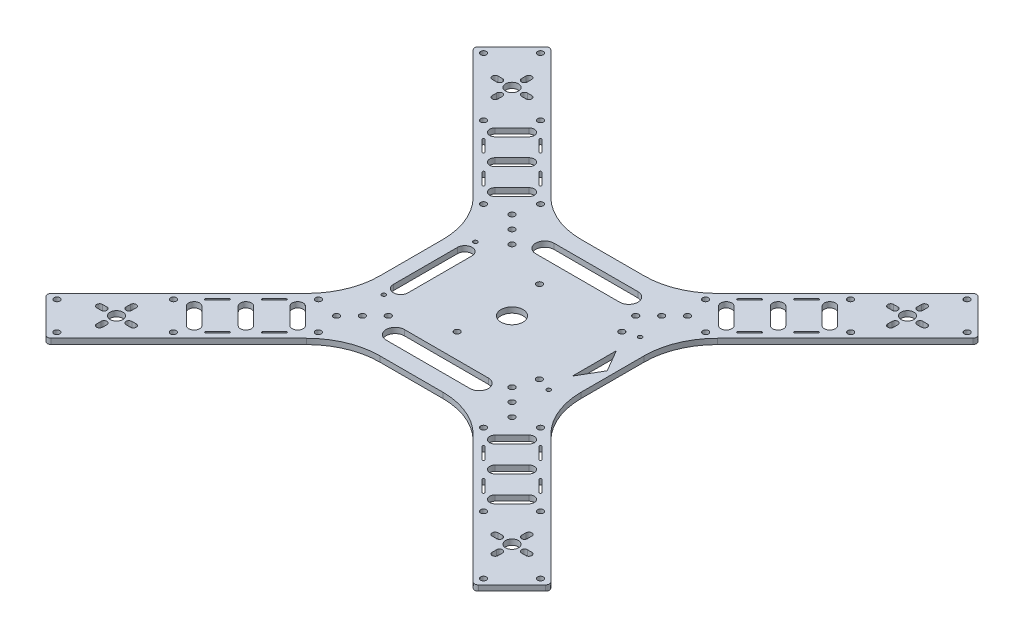
from build123d import *

# Parameters (mm, degrees)
SKETCH_1_R      = 1.6
SKETCH_1_R_2    = 3.5
SKETCH_1_R_3    = 1.1
SKETCH_1_R_4    = 6
EXTRUDE_2_DEPTH = 3
FILLET_1_R      = 2
FILLET_2_R      = 2


with BuildPart() as part:
    # 草图1 → 凸台-拉伸2 (new body)
    with BuildSketch(Plane(origin=(0, 0, 0), x_dir=(1, 0, 0), z_dir=(0, 1, 0))):
        with BuildLine():
            Line((-17.218254069, 55), (17.218254069, 55))
            ThreePointArc((17.218254069, 55), (32.525591364, 58.0448187), (45.502525317, 66.715728753))
            Line((45.502525317, 66.715728753), (116.672618896, 137.885822331))
            Line((116.672618896, 137.885822331), (137.885822331, 116.672618896))
            Line((137.885822331, 116.672618896), (66.715728753, 45.502525317))
            ThreePointArc((66.715728753, 45.502525317), (58.0448187, 32.525591364), (55, 17.218254069))
            Line((55, 17.218254069), (55, -17.218254069))
            ThreePointArc((55, -17.218254069), (58.0448187, -32.525591364), (66.715728753, -45.502525317))
            Line((66.715728753, -45.502525317), (137.885822331, -116.672618896))
            Line((137.885822331, -116.672618896), (116.672618896, -137.885822331))
            Line((116.672618896, -137.885822331), (45.502525317, -66.715728753))
            ThreePointArc((45.502525317, -66.715728753), (32.525591364, -58.0448187), (17.218254069, -55))
            Line((17.218254069, -55), (-17.218254069, -55))
            ThreePointArc((-17.218254069, -55), (-32.525591364, -58.0448187), (-45.502525317, -66.715728753))
            Line((-45.502525317, -66.715728753), (-116.672618896, -137.885822331))
            Line((-116.672618896, -137.885822331), (-137.885822331, -116.672618896))
            Line((-137.885822331, -116.672618896), (-66.715728753, -45.502525317))
            ThreePointArc((-66.715728753, -45.502525317), (-58.0448187, -32.525591364), (-55, -17.218254069))
            Line((-55, -17.218254069), (-55, 17.218254069))
            ThreePointArc((-55, 17.218254069), (-58.0448187, 32.525591364), (-66.715728753, 45.502525317))
            Line((-66.715728753, 45.502525317), (-137.885822331, 116.672618896))
            Line((-137.885822331, 116.672618896), (-116.672618896, 137.885822331))
            Line((-116.672618896, 137.885822331), (-45.502525317, 66.715728753))
            ThreePointArc((-45.502525317, 66.715728753), (-32.525591364, 58.0448187), (-17.218254069, 55))
        make_face()
        with Locations(Location((84.69848481, 100.254833996, 0), (0, 0, 270))):
            Circle(SKETCH_1_R, mode=Mode.SUBTRACT)
        with Locations(Location((100.254833996, 84.69848481, 0), (0, 0, 270))):
            Circle(SKETCH_1_R, mode=Mode.SUBTRACT)
        with Locations(Location((60.656854249, 45.100505063, 0), (0, 0, 270))):
            Circle(SKETCH_1_R, mode=Mode.SUBTRACT)
        with Locations(Location((45.100505063, 60.656854249, 0), (0, 0, 270))):
            Circle(SKETCH_1_R, mode=Mode.SUBTRACT)
        with Locations(Location((108.033008589, 108.033008589, 0), (0, 0, 270))):
            Circle(SKETCH_1_R_2, mode=Mode.SUBTRACT)
        with Locations(Location((116.518289963, 132.074639149, 0), (0, 0, 270))):
            Circle(SKETCH_1_R, mode=Mode.SUBTRACT)
        with Locations(Location((132.074639149, 116.518289963, 0), (0, 0, 270))):
            Circle(SKETCH_1_R, mode=Mode.SUBTRACT)
        with Locations(Location((100.254833996, -84.69848481, 0), (0, 0, 270))):
            Circle(SKETCH_1_R, mode=Mode.SUBTRACT)
        with Locations(Location((84.69848481, -100.254833996, 0), (0, 0, 270))):
            Circle(SKETCH_1_R, mode=Mode.SUBTRACT)
        with Locations(Location((45.100505063, -60.656854249, 0), (0, 0, 270))):
            Circle(SKETCH_1_R, mode=Mode.SUBTRACT)
        with Locations(Location((60.656854249, -45.100505063, 0), (0, 0, 270))):
            Circle(SKETCH_1_R, mode=Mode.SUBTRACT)
        with Locations(Location((108.033008589, -108.033008589, 0), (0, 0, 270))):
            Circle(SKETCH_1_R_2, mode=Mode.SUBTRACT)
        with Locations(Location((132.074639149, -116.518289963, 0), (0, 0, 270))):
            Circle(SKETCH_1_R, mode=Mode.SUBTRACT)
        with Locations(Location((116.518289963, -132.074639149, 0), (0, 0, 270))):
            Circle(SKETCH_1_R, mode=Mode.SUBTRACT)
        with Locations(Location((-84.69848481, -100.254833996, 0), (0, 0, 270))):
            Circle(SKETCH_1_R, mode=Mode.SUBTRACT)
        with Locations(Location((-100.254833996, -84.69848481, 0), (0, 0, 270))):
            Circle(SKETCH_1_R, mode=Mode.SUBTRACT)
        with Locations(Location((-60.656854249, -45.100505063, 0), (0, 0, 270))):
            Circle(SKETCH_1_R, mode=Mode.SUBTRACT)
        with Locations(Location((-45.100505063, -60.656854249, 0), (0, 0, 270))):
            Circle(SKETCH_1_R, mode=Mode.SUBTRACT)
        with Locations(Location((-108.033008589, -108.033008589, 0), (0, 0, 270))):
            Circle(SKETCH_1_R_2, mode=Mode.SUBTRACT)
        with Locations(Location((-116.518289963, -132.074639149, 0), (0, 0, 270))):
            Circle(SKETCH_1_R, mode=Mode.SUBTRACT)
        with Locations(Location((-132.074639149, -116.518289963, 0), (0, 0, 270))):
            Circle(SKETCH_1_R, mode=Mode.SUBTRACT)
        with Locations(Location((-100.254833996, 84.69848481, 0), (0, 0, 270))):
            Circle(SKETCH_1_R, mode=Mode.SUBTRACT)
        with Locations(Location((-84.69848481, 100.254833996, 0), (0, 0, 270))):
            Circle(SKETCH_1_R, mode=Mode.SUBTRACT)
        with Locations(Location((-45.100505063, 60.656854249, 0), (0, 0, 270))):
            Circle(SKETCH_1_R, mode=Mode.SUBTRACT)
        with Locations(Location((-60.656854249, 45.100505063, 0), (0, 0, 270))):
            Circle(SKETCH_1_R, mode=Mode.SUBTRACT)
        with Locations(Location((-108.033008589, 108.033008589, 0), (0, 0, 270))):
            Circle(SKETCH_1_R_2, mode=Mode.SUBTRACT)
        with Locations(Location((-132.074639149, 116.518289963, 0), (0, 0, 270))):
            Circle(SKETCH_1_R, mode=Mode.SUBTRACT)
        with Locations(Location((-116.518289963, 132.074639149, 0), (0, 0, 270))):
            Circle(SKETCH_1_R, mode=Mode.SUBTRACT)
        with Locations(Location((47.928932188, 47.928932188, 0), (0, 0, 270))):
            Circle(SKETCH_1_R, mode=Mode.SUBTRACT)
        with Locations(Location((40.857864376, 40.857864376, 0), (0, 0, 270))):
            Circle(SKETCH_1_R, mode=Mode.SUBTRACT)
        with Locations(Location((33.786796564, 33.786796564, 0), (0, 0, 270))):
            Circle(SKETCH_1_R, mode=Mode.SUBTRACT)
        with Locations(Location((47.928932188, -47.928932188, 0), (0, 0, 270))):
            Circle(SKETCH_1_R, mode=Mode.SUBTRACT)
        with Locations(Location((40.857864376, -40.857864376, 0), (0, 0, 270))):
            Circle(SKETCH_1_R, mode=Mode.SUBTRACT)
        with Locations(Location((33.786796564, -33.786796564, 0), (0, 0, 270))):
            Circle(SKETCH_1_R, mode=Mode.SUBTRACT)
        with Locations(Location((-47.928932188, -47.928932188, 0), (0, 0, 270))):
            Circle(SKETCH_1_R, mode=Mode.SUBTRACT)
        with Locations(Location((-40.857864376, -40.857864376, 0), (0, 0, 270))):
            Circle(SKETCH_1_R, mode=Mode.SUBTRACT)
        with Locations(Location((-33.786796564, -33.786796564, 0), (0, 0, 270))):
            Circle(SKETCH_1_R, mode=Mode.SUBTRACT)
        with Locations(Location((-47.928932188, 47.928932188, 0), (0, 0, 270))):
            Circle(SKETCH_1_R, mode=Mode.SUBTRACT)
        with Locations(Location((-40.857864376, 40.857864376, 0), (0, 0, 270))):
            Circle(SKETCH_1_R, mode=Mode.SUBTRACT)
        with Locations(Location((-33.786796564, 33.786796564, 0), (0, 0, 270))):
            Circle(SKETCH_1_R, mode=Mode.SUBTRACT)
        with Locations(Location((-44.999999799, 25, 0), (0, 0, 270))):
            Circle(SKETCH_1_R_3, mode=Mode.SUBTRACT)
        with Locations(Location((45.000000201, 25, 0), (0, 0, 270))):
            Circle(SKETCH_1_R_3, mode=Mode.SUBTRACT)
        with Locations(Location((45.000000201, -25, 0), (0, 0, 270))):
            Circle(SKETCH_1_R_3, mode=Mode.SUBTRACT)
        with Locations(Location((-44.999999799, -25, 0), (0, 0, 270))):
            Circle(SKETCH_1_R_3, mode=Mode.SUBTRACT)
        with Locations(Location((0, 0, 0), (0, 0, 270))):
            Circle(SKETCH_1_R_4, mode=Mode.SUBTRACT)
        with Locations(Location((-7.5, 22.5, 0), (0, 0, 270))):
            Circle(SKETCH_1_R, mode=Mode.SUBTRACT)
        with Locations(Location((37.5, 22.5, 0), (0, 0, 270))):
            Circle(SKETCH_1_R, mode=Mode.SUBTRACT)
        with Locations(Location((37.5, -22.5, 0), (0, 0, 270))):
            Circle(SKETCH_1_R, mode=Mode.SUBTRACT)
        with Locations(Location((-7.5, -22.5, 0), (0, 0, 270))):
            Circle(SKETCH_1_R, mode=Mode.SUBTRACT)
        with BuildLine():
            Line((70.202795796, 79.395183951), (79.395183951, 70.202795796))
            ThreePointArc((79.395183951, 70.202795796), (79.395183951, 65.960155108), (75.152543264, 65.960155108))
            Line((75.152543264, 65.960155108), (65.960155108, 75.152543264))
            ThreePointArc((65.960155108, 75.152543264), (65.960155108, 79.395183951), (70.202795796, 79.395183951))
        make_face(mode=Mode.SUBTRACT)
        with BuildLine():
            Line((56.060660172, 65.253048327), (65.253048327, 56.060660172))
            ThreePointArc((65.253048327, 56.060660172), (65.253048327, 51.818019485), (61.01040764, 51.818019485))
            Line((61.01040764, 51.818019485), (51.818019485, 61.01040764))
            ThreePointArc((51.818019485, 61.01040764), (51.818019485, 65.253048327), (56.060660172, 65.253048327))
        make_face(mode=Mode.SUBTRACT)
        with BuildLine():
            Line((84.344931419, 93.537319575), (93.537319575, 84.344931419))
            ThreePointArc((93.537319575, 84.344931419), (93.537319575, 80.102290732), (89.294678888, 80.102290732))
            Line((89.294678888, 80.102290732), (80.102290732, 89.294678888))
            ThreePointArc((80.102290732, 89.294678888), (80.102290732, 93.537319575), (84.344931419, 93.537319575))
        make_face(mode=Mode.SUBTRACT)
        with BuildLine():
            Line((109.633008589, 117.233008589), (109.633008589, 114.833008589))
            ThreePointArc((109.633008589, 114.833008589), (108.033008589, 113.233008589), (106.433008589, 114.833008589))
            Line((106.433008589, 114.833008589), (106.433008589, 117.233008589))
            ThreePointArc((106.433008589, 117.233008589), (108.033008589, 118.833008589), (109.633008589, 117.233008589))
        make_face(mode=Mode.SUBTRACT)
        with BuildLine():
            Line((117.233008589, 106.433008589), (114.833008589, 106.433008589))
            ThreePointArc((114.833008589, 106.433008589), (113.233008589, 108.033008589), (114.833008589, 109.633008589))
            Line((114.833008589, 109.633008589), (117.233008589, 109.633008589))
            ThreePointArc((117.233008589, 109.633008589), (118.833008589, 108.033008589), (117.233008589, 106.433008589))
        make_face(mode=Mode.SUBTRACT)
        with BuildLine():
            Line((106.433008589, 98.833008589), (106.433008589, 101.233008589))
            ThreePointArc((106.433008589, 101.233008589), (108.033008589, 102.833008589), (109.633008589, 101.233008589))
            Line((109.633008589, 101.233008589), (109.633008589, 98.833008589))
            ThreePointArc((109.633008589, 98.833008589), (108.033008589, 97.233008589), (106.433008589, 98.833008589))
        make_face(mode=Mode.SUBTRACT)
        with BuildLine():
            Line((98.833008589, 109.633008589), (101.233008589, 109.633008589))
            ThreePointArc((101.233008589, 109.633008589), (102.833008589, 108.033008589), (101.233008589, 106.433008589))
            Line((101.233008589, 106.433008589), (98.833008589, 106.433008589))
            ThreePointArc((98.833008589, 106.433008589), (97.233008589, 108.033008589), (98.833008589, 109.633008589))
        make_face(mode=Mode.SUBTRACT)
        with BuildLine():
            Line((65.253048327, -56.060660172), (56.060660172, -65.253048327))
            ThreePointArc((56.060660172, -65.253048327), (51.818019485, -65.253048327), (51.818019485, -61.01040764))
            Line((51.818019485, -61.01040764), (61.01040764, -51.818019485))
            ThreePointArc((61.01040764, -51.818019485), (65.253048327, -51.818019485), (65.253048327, -56.060660172))
        make_face(mode=Mode.SUBTRACT)
        with BuildLine():
            Line((79.395183951, -70.202795796), (70.202795796, -79.395183951))
            ThreePointArc((70.202795796, -79.395183951), (65.960155108, -79.395183951), (65.960155108, -75.152543264))
            Line((65.960155108, -75.152543264), (75.152543264, -65.960155108))
            ThreePointArc((75.152543264, -65.960155108), (79.395183951, -65.960155108), (79.395183951, -70.202795796))
        make_face(mode=Mode.SUBTRACT)
        with BuildLine():
            Line((93.537319575, -84.344931419), (84.344931419, -93.537319575))
            ThreePointArc((84.344931419, -93.537319575), (80.102290732, -93.537319575), (80.102290732, -89.294678888))
            Line((80.102290732, -89.294678888), (89.294678888, -80.102290732))
            ThreePointArc((89.294678888, -80.102290732), (93.537319575, -80.102290732), (93.537319575, -84.344931419))
        make_face(mode=Mode.SUBTRACT)
        with BuildLine():
            Line((117.233008589, -109.633008589), (114.833008589, -109.633008589))
            ThreePointArc((114.833008589, -109.633008589), (113.233008589, -108.033008589), (114.833008589, -106.433008589))
            Line((114.833008589, -106.433008589), (117.233008589, -106.433008589))
            ThreePointArc((117.233008589, -106.433008589), (118.833008589, -108.033008589), (117.233008589, -109.633008589))
        make_face(mode=Mode.SUBTRACT)
        with BuildLine():
            Line((106.433008589, -117.233008589), (106.433008589, -114.833008589))
            ThreePointArc((106.433008589, -114.833008589), (108.033008589, -113.233008589), (109.633008589, -114.833008589))
            Line((109.633008589, -114.833008589), (109.633008589, -117.233008589))
            ThreePointArc((109.633008589, -117.233008589), (108.033008589, -118.833008589), (106.433008589, -117.233008589))
        make_face(mode=Mode.SUBTRACT)
        with BuildLine():
            Line((98.833008589, -106.433008589), (101.233008589, -106.433008589))
            ThreePointArc((101.233008589, -106.433008589), (102.833008589, -108.033008589), (101.233008589, -109.633008589))
            Line((101.233008589, -109.633008589), (98.833008589, -109.633008589))
            ThreePointArc((98.833008589, -109.633008589), (97.233008589, -108.033008589), (98.833008589, -106.433008589))
        make_face(mode=Mode.SUBTRACT)
        with BuildLine():
            Line((109.633008589, -98.833008589), (109.633008589, -101.233008589))
            ThreePointArc((109.633008589, -101.233008589), (108.033008589, -102.833008589), (106.433008589, -101.233008589))
            Line((106.433008589, -101.233008589), (106.433008589, -98.833008589))
            ThreePointArc((106.433008589, -98.833008589), (108.033008589, -97.233008589), (109.633008589, -98.833008589))
        make_face(mode=Mode.SUBTRACT)
        with BuildLine():
            Line((-56.060660172, -65.253048327), (-65.253048327, -56.060660172))
            ThreePointArc((-65.253048327, -56.060660172), (-65.253048327, -51.818019485), (-61.01040764, -51.818019485))
            Line((-61.01040764, -51.818019485), (-51.818019485, -61.01040764))
            ThreePointArc((-51.818019485, -61.01040764), (-51.818019485, -65.253048327), (-56.060660172, -65.253048327))
        make_face(mode=Mode.SUBTRACT)
        with BuildLine():
            Line((-70.202795796, -79.395183951), (-79.395183951, -70.202795796))
            ThreePointArc((-79.395183951, -70.202795796), (-79.395183951, -65.960155108), (-75.152543264, -65.960155108))
            Line((-75.152543264, -65.960155108), (-65.960155108, -75.152543264))
            ThreePointArc((-65.960155108, -75.152543264), (-65.960155108, -79.395183951), (-70.202795796, -79.395183951))
        make_face(mode=Mode.SUBTRACT)
        with BuildLine():
            Line((-84.344931419, -93.537319575), (-93.537319575, -84.344931419))
            ThreePointArc((-93.537319575, -84.344931419), (-93.537319575, -80.102290732), (-89.294678888, -80.102290732))
            Line((-89.294678888, -80.102290732), (-80.102290732, -89.294678888))
            ThreePointArc((-80.102290732, -89.294678888), (-80.102290732, -93.537319575), (-84.344931419, -93.537319575))
        make_face(mode=Mode.SUBTRACT)
        with BuildLine():
            Line((-109.633008589, -117.233008589), (-109.633008589, -114.833008589))
            ThreePointArc((-109.633008589, -114.833008589), (-108.033008589, -113.233008589), (-106.433008589, -114.833008589))
            Line((-106.433008589, -114.833008589), (-106.433008589, -117.233008589))
            ThreePointArc((-106.433008589, -117.233008589), (-108.033008589, -118.833008589), (-109.633008589, -117.233008589))
        make_face(mode=Mode.SUBTRACT)
        with BuildLine():
            Line((-117.233008589, -106.433008589), (-114.833008589, -106.433008589))
            ThreePointArc((-114.833008589, -106.433008589), (-113.233008589, -108.033008589), (-114.833008589, -109.633008589))
            Line((-114.833008589, -109.633008589), (-117.233008589, -109.633008589))
            ThreePointArc((-117.233008589, -109.633008589), (-118.833008589, -108.033008589), (-117.233008589, -106.433008589))
        make_face(mode=Mode.SUBTRACT)
        with BuildLine():
            Line((-106.433008589, -98.833008589), (-106.433008589, -101.233008589))
            ThreePointArc((-106.433008589, -101.233008589), (-108.033008589, -102.833008589), (-109.633008589, -101.233008589))
            Line((-109.633008589, -101.233008589), (-109.633008589, -98.833008589))
            ThreePointArc((-109.633008589, -98.833008589), (-108.033008589, -97.233008589), (-106.433008589, -98.833008589))
        make_face(mode=Mode.SUBTRACT)
        with BuildLine():
            Line((-98.833008589, -109.633008589), (-101.233008589, -109.633008589))
            ThreePointArc((-101.233008589, -109.633008589), (-102.833008589, -108.033008589), (-101.233008589, -106.433008589))
            Line((-101.233008589, -106.433008589), (-98.833008589, -106.433008589))
            ThreePointArc((-98.833008589, -106.433008589), (-97.233008589, -108.033008589), (-98.833008589, -109.633008589))
        make_face(mode=Mode.SUBTRACT)
        with BuildLine():
            Line((-65.253048327, 56.060660172), (-56.060660172, 65.253048327))
            ThreePointArc((-56.060660172, 65.253048327), (-51.818019485, 65.253048327), (-51.818019485, 61.01040764))
            Line((-51.818019485, 61.01040764), (-61.01040764, 51.818019485))
            ThreePointArc((-61.01040764, 51.818019485), (-65.253048327, 51.818019485), (-65.253048327, 56.060660172))
        make_face(mode=Mode.SUBTRACT)
        with BuildLine():
            Line((-79.395183951, 70.202795796), (-70.202795796, 79.395183951))
            ThreePointArc((-70.202795796, 79.395183951), (-65.960155108, 79.395183951), (-65.960155108, 75.152543264))
            Line((-65.960155108, 75.152543264), (-75.152543264, 65.960155108))
            ThreePointArc((-75.152543264, 65.960155108), (-79.395183951, 65.960155108), (-79.395183951, 70.202795796))
        make_face(mode=Mode.SUBTRACT)
        with BuildLine():
            Line((-93.537319575, 84.344931419), (-84.344931419, 93.537319575))
            ThreePointArc((-84.344931419, 93.537319575), (-80.102290732, 93.537319575), (-80.102290732, 89.294678888))
            Line((-80.102290732, 89.294678888), (-89.294678888, 80.102290732))
            ThreePointArc((-89.294678888, 80.102290732), (-93.537319575, 80.102290732), (-93.537319575, 84.344931419))
        make_face(mode=Mode.SUBTRACT)
        with BuildLine():
            Line((-117.233008589, 109.633008589), (-114.833008589, 109.633008589))
            ThreePointArc((-114.833008589, 109.633008589), (-113.233008589, 108.033008589), (-114.833008589, 106.433008589))
            Line((-114.833008589, 106.433008589), (-117.233008589, 106.433008589))
            ThreePointArc((-117.233008589, 106.433008589), (-118.833008589, 108.033008589), (-117.233008589, 109.633008589))
        make_face(mode=Mode.SUBTRACT)
        with BuildLine():
            Line((-106.433008589, 117.233008589), (-106.433008589, 114.833008589))
            ThreePointArc((-106.433008589, 114.833008589), (-108.033008589, 113.233008589), (-109.633008589, 114.833008589))
            Line((-109.633008589, 114.833008589), (-109.633008589, 117.233008589))
            ThreePointArc((-109.633008589, 117.233008589), (-108.033008589, 118.833008589), (-106.433008589, 117.233008589))
        make_face(mode=Mode.SUBTRACT)
        with BuildLine():
            Line((-98.833008589, 106.433008589), (-101.233008589, 106.433008589))
            ThreePointArc((-101.233008589, 106.433008589), (-102.833008589, 108.033008589), (-101.233008589, 109.633008589))
            Line((-101.233008589, 109.633008589), (-98.833008589, 109.633008589))
            ThreePointArc((-98.833008589, 109.633008589), (-97.233008589, 108.033008589), (-98.833008589, 106.433008589))
        make_face(mode=Mode.SUBTRACT)
        with BuildLine():
            Line((-109.633008589, 98.833008589), (-109.633008589, 101.233008589))
            ThreePointArc((-109.633008589, 101.233008589), (-108.033008589, 102.833008589), (-106.433008589, 101.233008589))
            Line((-106.433008589, 101.233008589), (-106.433008589, 98.833008589))
            ThreePointArc((-106.433008589, 98.833008589), (-108.033008589, 97.233008589), (-109.633008589, 98.833008589))
        make_face(mode=Mode.SUBTRACT)
        with BuildLine():
            Line((-22.928932188, 45.857864376), (22.928932188, 45.857864376))
            ThreePointArc((22.928932188, 45.857864376), (27.928932188, 40.857864376), (22.928932188, 35.857864376))
            Line((22.928932188, 35.857864376), (-22.928932188, 35.857864376))
            ThreePointArc((-22.928932188, 35.857864376), (-27.928932188, 40.857864376), (-22.928932188, 45.857864376))
        make_face(mode=Mode.SUBTRACT)
        Polygon((45.000000201, 0), (45.000000201, 12), (52, 0), (45.000000201, -12), align=None, mode=Mode.SUBTRACT)
        with BuildLine():
            Line((-22.928932188, -45.857864376), (22.928932188, -45.857864376))
            ThreePointArc((22.928932188, -45.857864376), (27.928932188, -40.857864376), (22.928932188, -35.857864376))
            Line((22.928932188, -35.857864376), (-22.928932188, -35.857864376))
            ThreePointArc((-22.928932188, -35.857864376), (-27.928932188, -40.857864376), (-22.928932188, -45.857864376))
        make_face(mode=Mode.SUBTRACT)
        with BuildLine():
            Line((-39.293343511, 17.5), (-39.293343511, -17.5))
            ThreePointArc((-39.293343511, -17.5), (-43.293343511, -21.5), (-47.293343511, -17.5))
            Line((-47.293343511, -17.5), (-47.293343511, 17.5))
            ThreePointArc((-47.293343511, 17.5), (-43.293343511, 21.5), (-39.293343511, 17.5))
        make_face(mode=Mode.SUBTRACT)
        with BuildLine():
            Line((69.142135624, 54.292893219), (75.506096654, 60.656854249))
            ThreePointArc((75.506096654, 60.656854249), (76.213203436, 60.656854249), (76.213203436, 59.949747468))
            Line((76.213203436, 59.949747468), (69.849242405, 53.585786438))
            ThreePointArc((69.849242405, 53.585786438), (69.142135624, 53.585786438), (69.142135624, 54.292893219))
        make_face(mode=Mode.SUBTRACT)
        with BuildLine():
            Line((84.69848481, 69.849242405), (91.062445841, 76.213203436))
            ThreePointArc((91.062445841, 76.213203436), (91.769552622, 76.213203436), (91.769552622, 75.506096654))
            Line((91.769552622, 75.506096654), (85.405591591, 69.142135624))
            ThreePointArc((85.405591591, 69.142135624), (84.69848481, 69.142135624), (84.69848481, 69.849242405))
        make_face(mode=Mode.SUBTRACT)
        with BuildLine():
            Line((54.292893219, 69.142135624), (60.656854249, 75.506096654))
            ThreePointArc((60.656854249, 75.506096654), (60.656854249, 76.213203436), (59.949747468, 76.213203436))
            Line((59.949747468, 76.213203436), (53.585786438, 69.849242405))
            ThreePointArc((53.585786438, 69.849242405), (53.585786438, 69.142135624), (54.292893219, 69.142135624))
        make_face(mode=Mode.SUBTRACT)
        with BuildLine():
            Line((69.849242405, 84.69848481), (76.213203436, 91.062445841))
            ThreePointArc((76.213203436, 91.062445841), (76.213203436, 91.769552622), (75.506096654, 91.769552622))
            Line((75.506096654, 91.769552622), (69.142135624, 85.405591591))
            ThreePointArc((69.142135624, 85.405591591), (69.142135624, 84.69848481), (69.849242405, 84.69848481))
        make_face(mode=Mode.SUBTRACT)
        with BuildLine():
            Line((54.292893219, -69.142135624), (60.656854249, -75.506096654))
            ThreePointArc((60.656854249, -75.506096654), (60.656854249, -76.213203436), (59.949747468, -76.213203436))
            Line((59.949747468, -76.213203436), (53.585786438, -69.849242405))
            ThreePointArc((53.585786438, -69.849242405), (53.585786438, -69.142135624), (54.292893219, -69.142135624))
        make_face(mode=Mode.SUBTRACT)
        with BuildLine():
            Line((69.849242405, -84.69848481), (76.213203436, -91.062445841))
            ThreePointArc((76.213203436, -91.062445841), (76.213203436, -91.769552622), (75.506096654, -91.769552622))
            Line((75.506096654, -91.769552622), (69.142135624, -85.405591591))
            ThreePointArc((69.142135624, -85.405591591), (69.142135624, -84.69848481), (69.849242405, -84.69848481))
        make_face(mode=Mode.SUBTRACT)
        with BuildLine():
            Line((69.142135624, -54.292893219), (75.506096654, -60.656854249))
            ThreePointArc((75.506096654, -60.656854249), (76.213203436, -60.656854249), (76.213203436, -59.949747468))
            Line((76.213203436, -59.949747468), (69.849242405, -53.585786438))
            ThreePointArc((69.849242405, -53.585786438), (69.142135624, -53.585786438), (69.142135624, -54.292893219))
        make_face(mode=Mode.SUBTRACT)
        with BuildLine():
            Line((84.69848481, -69.849242405), (91.062445841, -76.213203436))
            ThreePointArc((91.062445841, -76.213203436), (91.769552622, -76.213203436), (91.769552622, -75.506096654))
            Line((91.769552622, -75.506096654), (85.405591591, -69.142135624))
            ThreePointArc((85.405591591, -69.142135624), (84.69848481, -69.142135624), (84.69848481, -69.849242405))
        make_face(mode=Mode.SUBTRACT)
        with BuildLine():
            Line((-69.142135624, -54.292893219), (-75.506096654, -60.656854249))
            ThreePointArc((-75.506096654, -60.656854249), (-76.213203436, -60.656854249), (-76.213203436, -59.949747468))
            Line((-76.213203436, -59.949747468), (-69.849242405, -53.585786438))
            ThreePointArc((-69.849242405, -53.585786438), (-69.142135624, -53.585786438), (-69.142135624, -54.292893219))
        make_face(mode=Mode.SUBTRACT)
        with BuildLine():
            Line((-84.69848481, -69.849242405), (-91.06244584, -76.213203436))
            ThreePointArc((-91.06244584, -76.213203436), (-91.769552622, -76.213203436), (-91.769552622, -75.506096654))
            Line((-91.769552622, -75.506096654), (-85.405591591, -69.142135624))
            ThreePointArc((-85.405591591, -69.142135624), (-84.69848481, -69.142135624), (-84.69848481, -69.849242405))
        make_face(mode=Mode.SUBTRACT)
        with BuildLine():
            Line((-54.292893219, -69.142135624), (-60.656854249, -75.506096654))
            ThreePointArc((-60.656854249, -75.506096654), (-60.656854249, -76.213203436), (-59.949747468, -76.213203436))
            Line((-59.949747468, -76.213203436), (-53.585786438, -69.849242405))
            ThreePointArc((-53.585786438, -69.849242405), (-53.585786438, -69.142135624), (-54.292893219, -69.142135624))
        make_face(mode=Mode.SUBTRACT)
        with BuildLine():
            Line((-69.849242405, -84.69848481), (-76.213203436, -91.062445841))
            ThreePointArc((-76.213203436, -91.062445841), (-76.213203436, -91.769552622), (-75.506096654, -91.769552622))
            Line((-75.506096654, -91.769552622), (-69.142135624, -85.405591591))
            ThreePointArc((-69.142135624, -85.405591591), (-69.142135624, -84.69848481), (-69.849242405, -84.69848481))
        make_face(mode=Mode.SUBTRACT)
        with BuildLine():
            Line((-54.292893219, 69.142135624), (-60.656854249, 75.506096654))
            ThreePointArc((-60.656854249, 75.506096654), (-60.656854249, 76.213203436), (-59.949747468, 76.213203436))
            Line((-59.949747468, 76.213203436), (-53.585786438, 69.849242405))
            ThreePointArc((-53.585786438, 69.849242405), (-53.585786438, 69.142135624), (-54.292893219, 69.142135624))
        make_face(mode=Mode.SUBTRACT)
        with BuildLine():
            Line((-69.849242405, 84.69848481), (-76.213203436, 91.062445841))
            ThreePointArc((-76.213203436, 91.062445841), (-76.213203436, 91.769552622), (-75.506096654, 91.769552622))
            Line((-75.506096654, 91.769552622), (-69.142135624, 85.405591591))
            ThreePointArc((-69.142135624, 85.405591591), (-69.142135624, 84.69848481), (-69.849242405, 84.69848481))
        make_face(mode=Mode.SUBTRACT)
        with BuildLine():
            Line((-69.142135624, 54.292893219), (-75.506096654, 60.656854249))
            ThreePointArc((-75.506096654, 60.656854249), (-76.213203436, 60.656854249), (-76.213203436, 59.949747468))
            Line((-76.213203436, 59.949747468), (-69.849242405, 53.585786438))
            ThreePointArc((-69.849242405, 53.585786438), (-69.142135624, 53.585786438), (-69.142135624, 54.292893219))
        make_face(mode=Mode.SUBTRACT)
        with BuildLine():
            Line((-84.69848481, 69.849242405), (-91.062445841, 76.213203436))
            ThreePointArc((-91.062445841, 76.213203436), (-91.769552622, 76.213203436), (-91.769552622, 75.506096654))
            Line((-91.769552622, 75.506096654), (-85.405591591, 69.142135624))
            ThreePointArc((-85.405591591, 69.142135624), (-84.69848481, 69.142135624), (-84.69848481, 69.849242405))
        make_face(mode=Mode.SUBTRACT)
    extrude(amount=EXTRUDE_2_DEPTH)

    # 圆角1
    fillet_1_edges = [part.edges().sort_by_distance(p)[0] for p in [
        (137.885822331, 1.5, -116.672618896),
    ]]
    fillet(fillet_1_edges, radius=FILLET_1_R)

    # 圆角2
    fillet_2_edges = [part.edges().sort_by_distance(p)[0] for p in [
        (-137.885822331, 1.5, -116.672618896),
        (-116.672618896, 1.5, -137.885822331),
        (116.672618896, 1.5, -137.885822331),
        (137.885822331, 1.5, 116.672618896),
        (116.672618896, 1.5, 137.885822331),
        (-116.672618896, 1.5, 137.885822331),
        (-137.885822331, 1.5, 116.672618896),
    ]]
    fillet(fillet_2_edges, radius=FILLET_2_R)


solid = part.part
